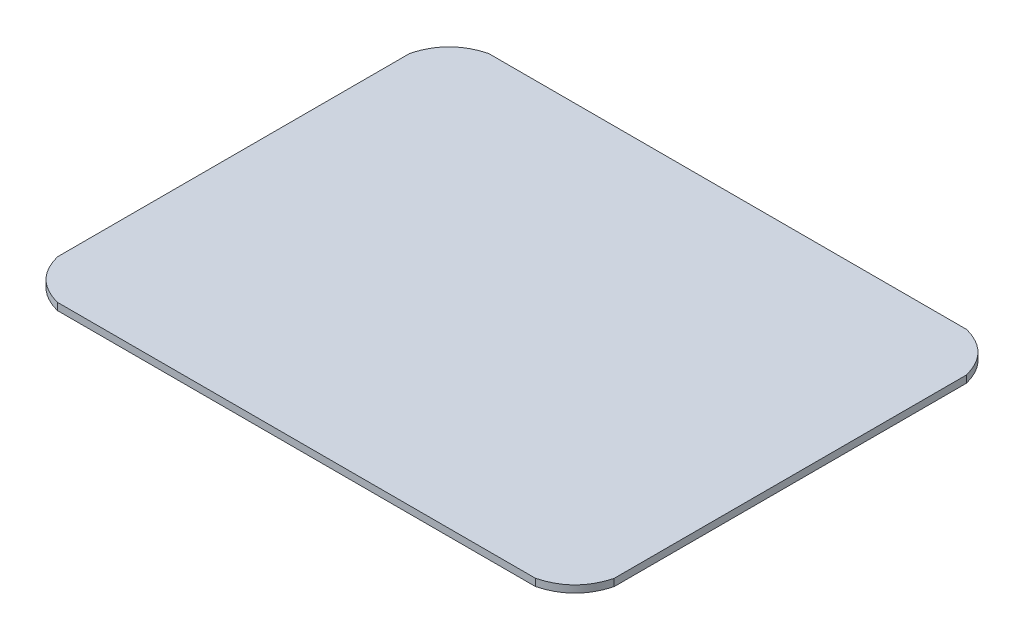
from build123d import *

# Parameters (mm, degrees)
BOSS_EXTRUDE1_DEPTH = 3.175


with BuildPart() as part:
    # Sketch1 → Boss-Extrude1 (new body)
    with BuildSketch(Plane(origin=(0, 0, 0), x_dir=(1, 0, 0), z_dir=(0, 1, 0))):
        with BuildLine():
            Line((123.03125, -77.8604715), (123.03125, 77.8604715))
            add(Edge.make_bspline(
                [(105.623942912, 95.25), (119.376750647, 91.610533651), (123.03125, 77.8604715)],
                knots=[0, 0, 0, 1, 1, 1], degree=2))
            Line((105.623942912, 95.25), (-105.623942912, 95.25))
            add(Edge.make_bspline(
                [(-105.623942912, 95.25), (-119.376750647, 91.610533651), (-123.03125, 77.8604715)],
                knots=[0, 0, 0, 1, 1, 1], degree=2))
            Line((-123.03125, 77.8604715), (-123.03125, -77.8604715))
            add(Edge.make_bspline(
                [(-105.623942912, -95.25), (-119.376750647, -91.610533651), (-123.03125, -77.8604715)],
                knots=[0, 0, 0, 1, 1, 1], degree=2))
            Line((-105.623942912, -95.25), (105.623942912, -95.25))
            add(Edge.make_bspline(
                [(105.623942912, -95.25), (119.376750647, -91.610533651), (123.03125, -77.8604715)],
                knots=[0, 0, 0, 1, 1, 1], degree=2))
        make_face()
    extrude(amount=BOSS_EXTRUDE1_DEPTH)


solid = part.part
